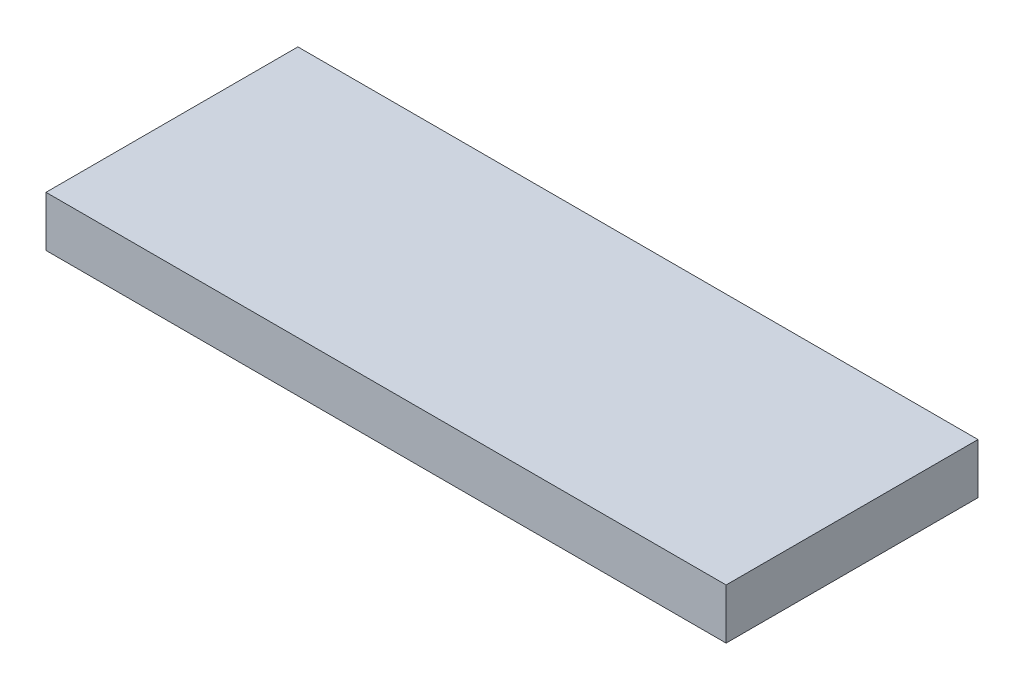
from build123d import *

# Parameters (mm, degrees)
SKETCH_2_W      = 54
SKETCH_2_H      = 20
EXTRUDE_1_DEPTH = 4


with BuildPart() as part:
    # 草图2 → 凸台-拉伸1 (new body)
    with BuildSketch(Plane(origin=(0, 0, 0), x_dir=(1, 0, 0), z_dir=(0, 1, 0))):
        with Locations((27, -10)):
            Rectangle(SKETCH_2_W, SKETCH_2_H)
    extrude(amount=EXTRUDE_1_DEPTH)


solid = part.part
